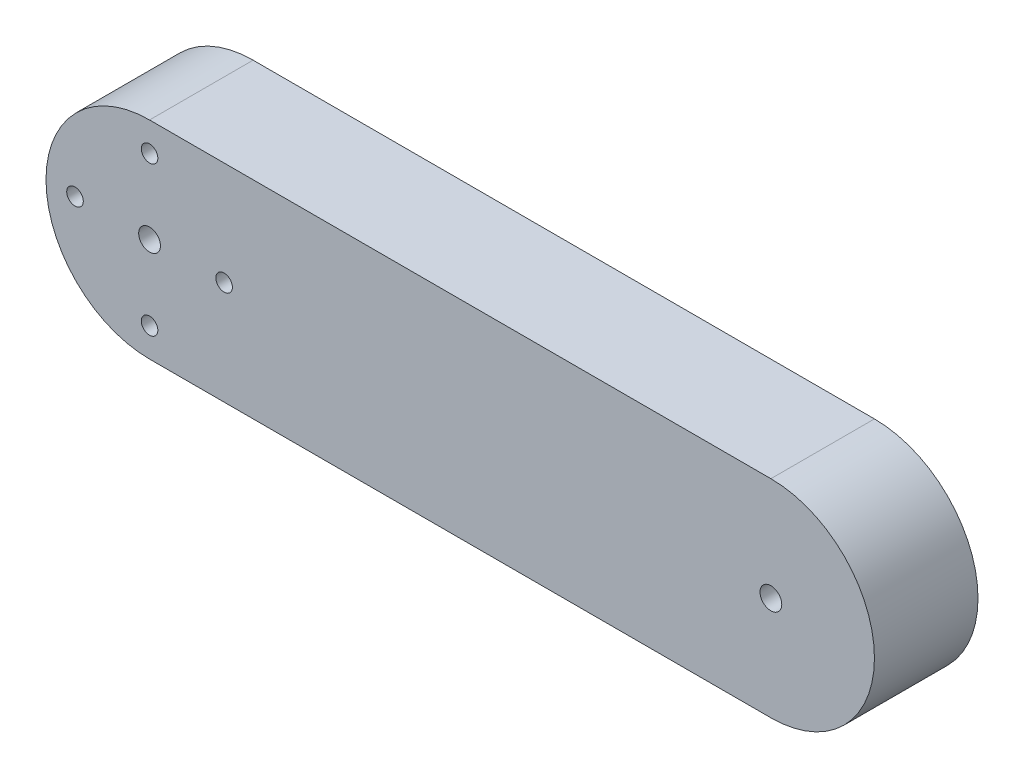
from build123d import *

# Parameters (mm, degrees)
EXTRUDE_1_DEPTH = 10
M2X0_4_1_D      = 1.6
M2X0_4_2_D      = 1.6


with BuildPart() as part:
    # ｽｹｯﾁ2 → ﾎﾞｽ - 押し出し1 (new body)
    with BuildSketch(Plane.XY):
        with BuildLine():
            ThreePointArc((-20, 0), (-22.928932188, 7.071067812), (-30, 10))
            Line((-30, 10), (-30, 1.05))
            ThreePointArc((-30, 1.05), (-29.25753788, 0.74246212), (-28.95, 0))
            ThreePointArc((-28.95, 0), (-29.25753788, -0.74246212), (-30, -1.05))
            Line((-30, -1.05), (-30, -10))
            ThreePointArc((-30, -10), (-22.928932188, -7.071067812), (-20, 0))
        make_face()
        with BuildLine():
            Line((-30, 1.05), (-30, 10))
            ThreePointArc((-30, 10), (-40, 0), (-30, -10))
            Line((-30, -10), (-30, -1.05))
            ThreePointArc((-30, -1.05), (-31.05, 0), (-30, 1.05))
        make_face()
        with BuildLine():
            Line((30, 10), (-30, 10))
            ThreePointArc((-30, 10), (-22.928932188, 7.071067812), (-20, 0))
            ThreePointArc((-20, 0), (-22.928932188, -7.071067812), (-30, -10))
            Line((-30, -10), (30, -10))
            ThreePointArc((30, -10), (20, 0), (30, 10))
        make_face()
        with BuildLine():
            ThreePointArc((40, 0), (37.071067812, 7.071067812), (30, 10))
            Line((30, 10), (30, 1.05))
            ThreePointArc((30, 1.05), (30.74246212, 0.74246212), (31.05, 0))
            ThreePointArc((31.05, 0), (30.74246212, -0.74246212), (30, -1.05))
            Line((30, -1.05), (30, -10))
            ThreePointArc((30, -10), (37.071067812, -7.071067812), (40, 0))
        make_face()
        with BuildLine():
            Line((30, 1.05), (30, 10))
            ThreePointArc((30, 10), (20, 0), (30, -10))
            Line((30, -10), (30, -1.05))
            ThreePointArc((30, -1.05), (28.95, 0), (30, 1.05))
        make_face()
    extrude(amount=EXTRUDE_1_DEPTH)

    # M2x0.4 ねじ穴1 (through all)
    with Locations(Plane.XY.offset(10)):
        with Locations((-30, 7.2), (-37.2, 0), (-30, -7.2)):
            Hole(M2X0_4_1_D / 2)

    # M2x0.4 ねじ穴2 (through all)
    with Locations(Plane.XY.offset(10)):
        with Locations((-22.8, 0)):
            Hole(M2X0_4_2_D / 2)


solid = part.part
